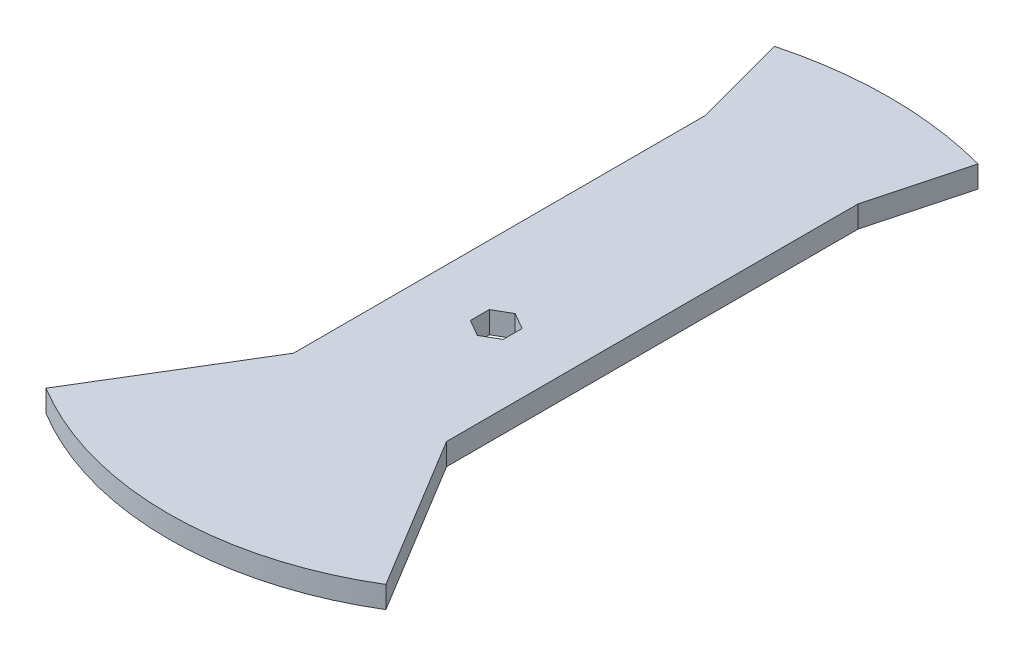
from build123d import *

# Parameters (mm, degrees)
BOSS_EXTRUDE1_DEPTH = 3.175
CUT_EXTRUDE1_REACH  = 126.672


with BuildPart() as part:
    # Sketch1 → Boss-Extrude1 (new, symmetric)
    with BuildSketch(Plane(origin=(0, 0, 0), x_dir=(1, 0, 0), z_dir=(0, 1, 0))):
        with BuildLine():
            Line((-22.225, 82.944829198), (-22.225, -36.659057496))
            Line((-22.225, -36.659057496), (-49.38024545, -81.450315281))
            ThreePointArc((-49.38024545, -81.450315281), (0, -95.25), (49.38024545, -81.450315281))
            Line((49.38024545, -81.450315281), (22.225, -36.659057496))
            Line((22.225, -36.659057496), (22.225, 82.944829198))
            Line((22.225, 82.944829198), (29.583016855, 110.405321945))
            ThreePointArc((29.583016855, 110.405321945), (0, 114.3), (-29.583016855, 110.405321945))
            Line((-29.583016855, 110.405321945), (-22.225, 82.944829198))
        make_face()
    extrude(amount=BOSS_EXTRUDE1_DEPTH, both=True)

    # Sketch2 → Cut-Extrude1 (cut, up to next)
    with BuildSketch(Plane(origin=(0, 3.175, 0), x_dir=(1, 0, 0), z_dir=(0, 1, 0)), mode=Mode.PRIVATE) as cut_extrude1_sk1:
        Polygon((4.7625, -2.749630657), (4.7625, 2.749630657), (0, 5.499261314), (-4.7625, 2.749630657), (-4.7625, -2.749630657), (0, -5.499261314), align=None)
    cut_extrude1_tool1 = extrude(cut_extrude1_sk1.sketch, amount=-CUT_EXTRUDE1_REACH, mode=Mode.PRIVATE) & part.part
    add(cut_extrude1_tool1.solids().sort_by_distance((0, 3.175, 0))[0], mode=Mode.SUBTRACT)


solid = part.part
